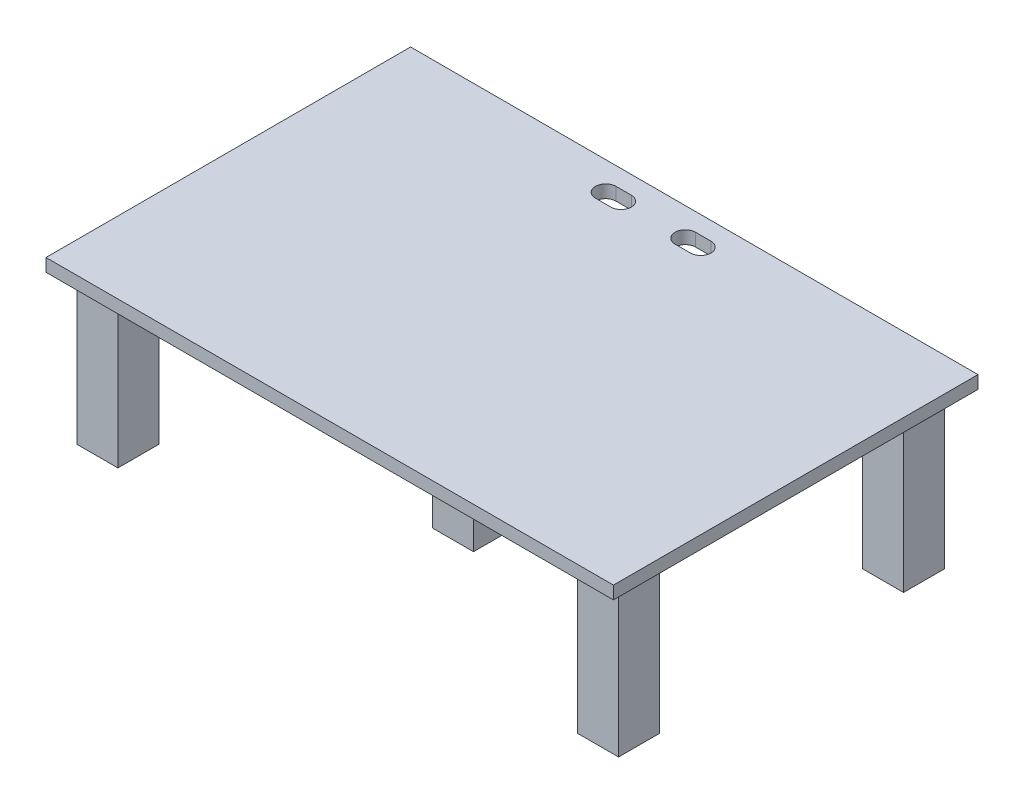
from build123d import *

# Parameters (mm, degrees)
V4_UPPER_DECK_221X142_PROFILE_W  = 221
V4_UPPER_DECK_221X142_PROFILE_H  = 142
V4_UPPER_DECK_5MM_DEPTH          = 5
V4_FIVE_SUPPORT_POSTS_PROFILE_W  = 16
V4_FIVE_SUPPORT_POSTS_PROFILE_H  = 16
V4_FIVE_SUPPORT_POSTS_59MM_DEPTH = 59
V4_UPPER_TWO_CABLE_SLOTS_DEPTH   = 5.5
V4_FIVE_M3_PILOTS_PROFILE_R      = 1.4
V4_POST_PILOT_HOLES_DEPTH        = 14


with BuildPart() as part:
    # V4_upper_deck_221x142_profile → V4_upper_deck_5mm (new body)
    with BuildSketch(Plane(origin=(0, 4, 0), x_dir=(1, 0, 0), z_dir=(0, 1, 0))):
        with Locations((12.5, -115)):
            Rectangle(V4_UPPER_DECK_221X142_PROFILE_W, V4_UPPER_DECK_221X142_PROFILE_H)
    extrude(amount=-V4_UPPER_DECK_5MM_DEPTH)

    # V4_five_support_posts_profile → V4_five_support_posts_59mm (add)
    with BuildSketch(Plane(origin=(0, -1, 0), x_dir=(1, 0, 0), z_dir=(0, 1, 0))):
        with Locations((-85, -60)):
            Rectangle(V4_FIVE_SUPPORT_POSTS_PROFILE_W, V4_FIVE_SUPPORT_POSTS_PROFILE_H)
        with Locations((110, -60)):
            Rectangle(V4_FIVE_SUPPORT_POSTS_PROFILE_W, V4_FIVE_SUPPORT_POSTS_PROFILE_H)
        with Locations((-85, -171)):
            Rectangle(V4_FIVE_SUPPORT_POSTS_PROFILE_W, V4_FIVE_SUPPORT_POSTS_PROFILE_H)
        with Locations((110, -171)):
            Rectangle(V4_FIVE_SUPPORT_POSTS_PROFILE_W, V4_FIVE_SUPPORT_POSTS_PROFILE_H)
        with Locations((12.5, -130)):
            Rectangle(V4_FIVE_SUPPORT_POSTS_PROFILE_W, V4_FIVE_SUPPORT_POSTS_PROFILE_H)
    extrude(amount=-V4_FIVE_SUPPORT_POSTS_59MM_DEPTH)

    # V4_upper_two_cable_slots_profile → V4_upper_two_cable_slots (cut)
    with BuildSketch(Plane(origin=(0, 4, 0), x_dir=(1, 0, 0), z_dir=(0, 1, 0))):
        with BuildLine():
            Line((-11, -51), (-5, -51))
            ThreePointArc((-5, -51), (-1, -55), (-5, -59))
            Line((-5, -59), (-11, -59))
            ThreePointArc((-11, -59), (-15, -55), (-11, -51))
        make_face()
        with BuildLine():
            Line((20, -51), (26, -51))
            ThreePointArc((26, -51), (30, -55), (26, -59))
            Line((26, -59), (20, -59))
            ThreePointArc((20, -59), (16, -55), (20, -51))
        make_face()
    extrude(amount=-V4_UPPER_TWO_CABLE_SLOTS_DEPTH, mode=Mode.SUBTRACT)

    # V4_five_M3_pilots_profile → V4_post_pilot_holes (cut)
    with BuildSketch(Plane(origin=(0, -60, 0), x_dir=(1, 0, 0), z_dir=(0, 1, 0))):
        with Locations(Location((-85, -60, 0), (0, 0, 270))):
            Circle(V4_FIVE_M3_PILOTS_PROFILE_R)
        with Locations(Location((110, -60, 0), (0, 0, 270))):
            Circle(V4_FIVE_M3_PILOTS_PROFILE_R)
        with Locations(Location((-85, -171, 0), (0, 0, 270))):
            Circle(V4_FIVE_M3_PILOTS_PROFILE_R)
        with Locations(Location((110, -171, 0), (0, 0, 270))):
            Circle(V4_FIVE_M3_PILOTS_PROFILE_R)
        with Locations(Location((12.5, -130, 0), (0, 0, 270))):
            Circle(V4_FIVE_M3_PILOTS_PROFILE_R)
    extrude(amount=V4_POST_PILOT_HOLES_DEPTH, mode=Mode.SUBTRACT)


solid = part.part
